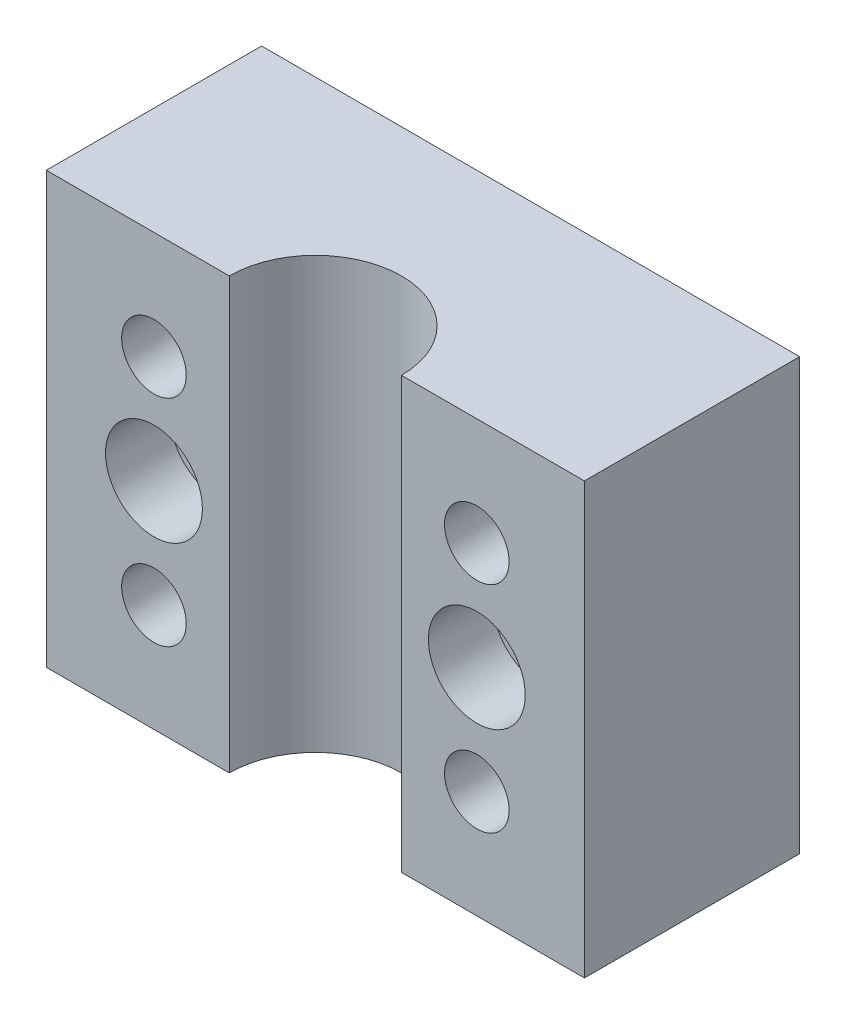
from build123d import *

# Parameters (mm, degrees)
SKETCH1_W           = 50
SKETCH1_H           = 40
BOSS_EXTRUDE1_DEPTH = 20
SKETCH2_R           = 8
CUT_EXTRUDE1_DEPTH  = 43
SKETCH3_R           = 3
CUT_EXTRUDE2_DEPTH  = 43
SKETCH4_R           = 2.75
CUT_EXTRUDE3_DEPTH  = 50
SKETCH5_R           = 4.5
CUT_EXTRUDE4_DEPTH  = 6
CUT_EXTRUDE5_DEPTH  = 5


with BuildPart() as part:
    # Sketch1 → Boss-Extrude1 (new body)
    with BuildSketch(Plane.XY):
        with Locations((25, 20)):
            Rectangle(SKETCH1_W, SKETCH1_H)
    extrude(amount=BOSS_EXTRUDE1_DEPTH)

    # Sketch2 → Cut-Extrude1 (cut)
    with BuildSketch(Plane(origin=(0, 40, 0), x_dir=(1, 0, 0), z_dir=(0, 1, 0))):
        with Locations((25, -20)):
            Circle(SKETCH2_R)
    extrude(amount=-CUT_EXTRUDE1_DEPTH, mode=Mode.SUBTRACT)

    # Sketch3 → Cut-Extrude2 (cut)
    with BuildSketch(Plane.XY.offset(20)):
        with Locations((10, 30)):
            Circle(SKETCH3_R)
        with Locations((10, 10)):
            Circle(SKETCH3_R)
        with Locations((40, 30)):
            Circle(SKETCH3_R)
        with Locations((40, 10)):
            Circle(SKETCH3_R)
    extrude(amount=-CUT_EXTRUDE2_DEPTH, mode=Mode.SUBTRACT)

    # Sketch4 → Cut-Extrude3 (cut)
    with BuildSketch(Plane.XY.offset(20)):
        with Locations((10, 20)):
            Circle(SKETCH4_R)
        with Locations((40, 20)):
            Circle(SKETCH4_R)
    extrude(amount=-CUT_EXTRUDE3_DEPTH, mode=Mode.SUBTRACT)

    # Sketch5 → Cut-Extrude4 (cut)
    with BuildSketch(Plane.XY.offset(20)):
        with Locations((10, 20)):
            Circle(SKETCH5_R)
        with Locations((40, 20)):
            Circle(SKETCH5_R)
    extrude(amount=-CUT_EXTRUDE4_DEPTH, mode=Mode.SUBTRACT)

    # Sketch6 → Cut-Extrude5 (cut)
    with BuildSketch(Plane(origin=(0, 0, 0), x_dir=(-1, 0, 0), z_dir=(0, 0, -1))):
        Polygon((-3.937822174, 10), (-6.968911087, 15.25), (-13.031088913, 15.25), (-16.062177826, 10), (-13.031088913, 4.75), (-6.968911087, 4.75), align=None)
        Polygon((-43.031088913, 15.25), (-46.062177826, 10), (-43.031088913, 4.75), (-36.968911087, 4.75), (-33.937822174, 10), (-36.968911087, 15.25), align=None)
        Polygon((-36.968911087, 24.75), (-33.937822174, 30), (-36.968911087, 35.25), (-43.031088913, 35.25), (-46.062177826, 30), (-43.031088913, 24.75), align=None)
        Polygon((-6.968911087, 24.75), (-3.937822174, 30), (-6.968911087, 35.25), (-13.031088913, 35.25), (-16.062177826, 30), (-13.031088913, 24.75), align=None)
    extrude(amount=-CUT_EXTRUDE5_DEPTH, mode=Mode.SUBTRACT)


solid = part.part
